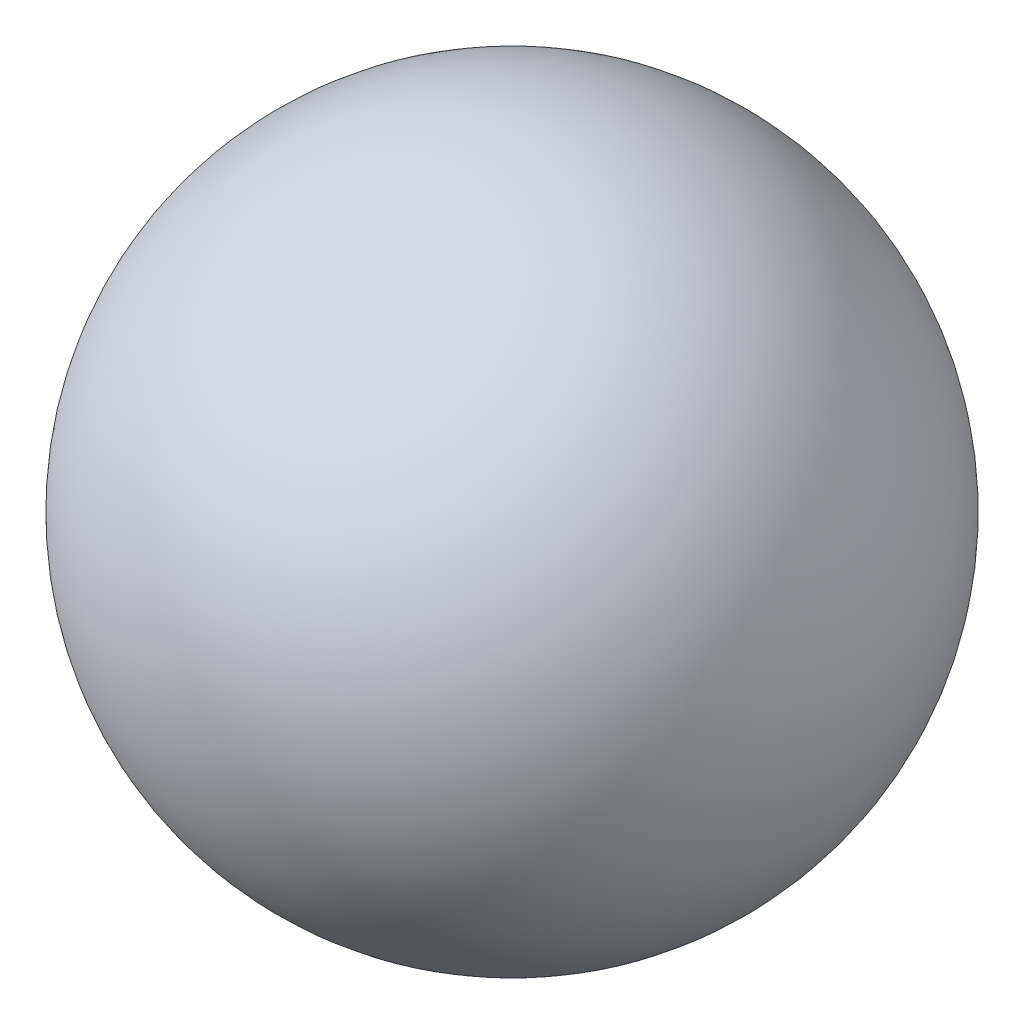
from build123d import *


with BuildPart() as part:
    # Esquisse1 → Révolution4 (revolve)
    with BuildSketch(Plane.XY):
        with BuildLine():
            Line((0, 11.5), (0, -11.5))
            ThreePointArc((0, -11.5), (-11.5, 0), (0, 11.5))
        make_face()
    revolve(axis=Axis((0, 11.5, 0), (0, -1, 0)))


solid = part.part
